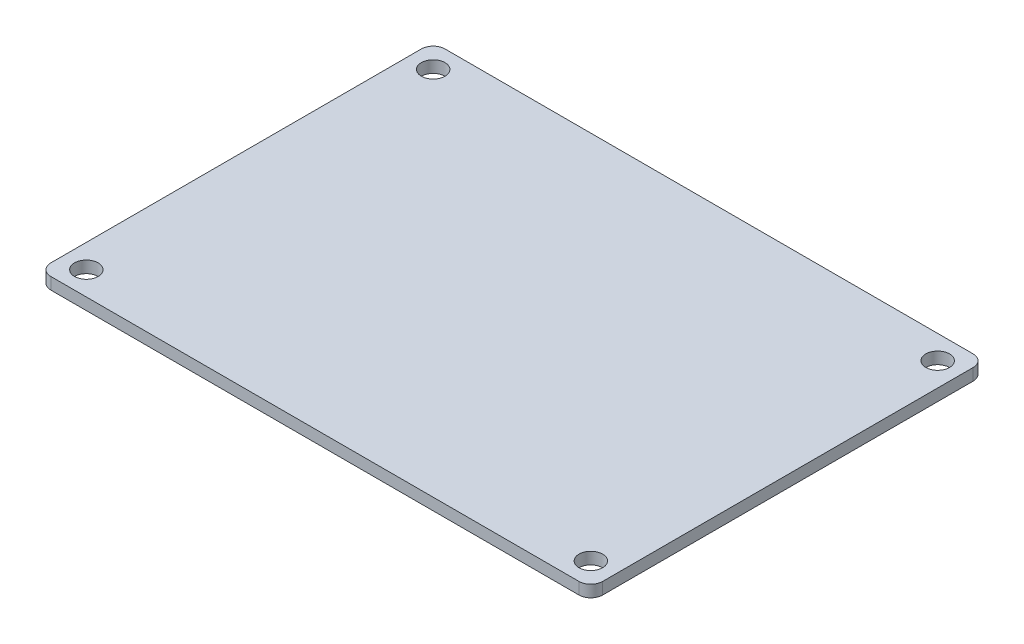
from build123d import *

# Parameters (mm, degrees)
SKETCH1_W           = 70
SKETCH1_H           = 50
BOSS_EXTRUDE1_DEPTH = 1.5
SKETCH2_R           = 1.5
CUT_EXTRUDE1_DEPTH  = 10
FILLET1_R           = 1.5


with BuildPart() as part:
    # Sketch1 → Boss-Extrude1 (new body)
    with BuildSketch(Plane(origin=(0, 0, 0), x_dir=(1, 0, 0), z_dir=(0, 1, 0))):
        Rectangle(SKETCH1_W, SKETCH1_H)
    extrude(amount=BOSS_EXTRUDE1_DEPTH)

    # Sketch2 → Cut-Extrude1 (cut)
    with BuildSketch(Plane(origin=(0, 1.5, 0), x_dir=(1, 0, 0), z_dir=(0, 1, 0))):
        with Locations(Location((-32, -22, 0), (0, 0, 270))):
            Circle(SKETCH2_R)
        with Locations(Location((32, -22, 0), (0, 0, 270))):
            Circle(SKETCH2_R)
        with Locations(Location((32, 22, 0), (0, 0, 270))):
            Circle(SKETCH2_R)
        with Locations(Location((-32, 22, 0), (0, 0, 270))):
            Circle(SKETCH2_R)
    extrude(amount=-CUT_EXTRUDE1_DEPTH, mode=Mode.SUBTRACT)

    # Fillet1
    fillet1_edges = [part.edges().sort_by_distance(p)[0] for p in [
        (35, 0.75, 25),
        (-35, 0.75, 25),
        (-35, 0.75, -25),
        (35, 0.75, -25),
    ]]
    fillet(fillet1_edges, radius=FILLET1_R)


solid = part.part
